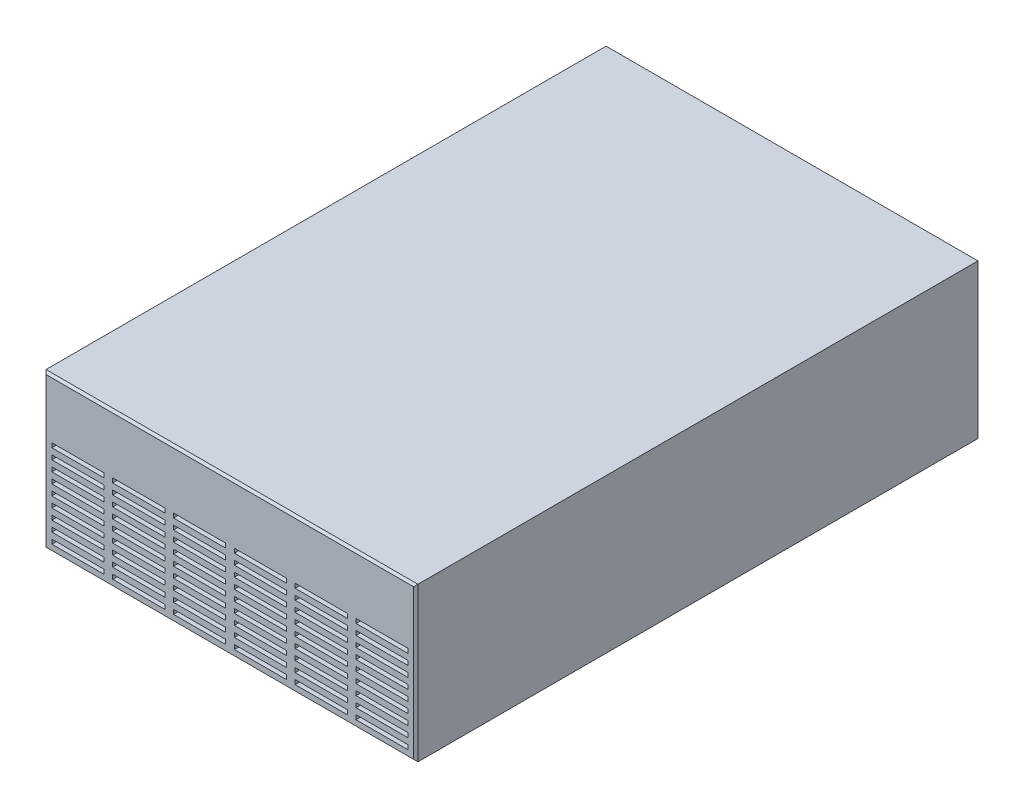
from build123d import *

# Parameters (mm, degrees)
SKETCH1_W           = 428
SKETCH1_H           = 177
BOSS_EXTRUDE1_DEPTH = 647
SKETCH2_W           = 60
SKETCH2_H           = 5
CUT_EXTRUDE1_DEPTH  = 5
CHAMFER1_SIZE       = 2.5


with BuildPart() as part:
    # Sketch1 → Boss-Extrude1 (new body)
    with BuildSketch(Plane.XY):
        with Locations((214, 88.5)):
            Rectangle(SKETCH1_W, SKETCH1_H)
    extrude(amount=-BOSS_EXTRUDE1_DEPTH)

    # Sketch2 → Cut-Extrude1 (cut)
    with BuildSketch(Plane.XY):
        with Locations((109.265806659, 11.356001872)):
            Rectangle(SKETCH2_W, SKETCH2_H)
        with Locations((39.265806659, 11.356001872)):
            Rectangle(SKETCH2_W, SKETCH2_H)
        with Locations((179.265806659, 11.356001872)):
            Rectangle(SKETCH2_W, SKETCH2_H)
        with Locations((249.265806659, 11.356001872)):
            Rectangle(SKETCH2_W, SKETCH2_H)
        with Locations((319.265806659, 11.356001872)):
            Rectangle(SKETCH2_W, SKETCH2_H)
        with Locations((389.265806659, 11.356001872)):
            Rectangle(SKETCH2_W, SKETCH2_H)
        with Locations((109.265806659, 23.356001872)):
            Rectangle(SKETCH2_W, SKETCH2_H)
        with Locations((179.265806659, 23.356001872)):
            Rectangle(SKETCH2_W, SKETCH2_H)
        with Locations((249.265806659, 23.356001872)):
            Rectangle(SKETCH2_W, SKETCH2_H)
        with Locations((319.265806659, 23.356001872)):
            Rectangle(SKETCH2_W, SKETCH2_H)
        with Locations((389.265806659, 23.356001872)):
            Rectangle(SKETCH2_W, SKETCH2_H)
        with Locations((109.265806659, 35.356001872)):
            Rectangle(SKETCH2_W, SKETCH2_H)
        with Locations((179.265806659, 35.356001872)):
            Rectangle(SKETCH2_W, SKETCH2_H)
        with Locations((249.265806659, 35.356001872)):
            Rectangle(SKETCH2_W, SKETCH2_H)
        with Locations((319.265806659, 35.356001872)):
            Rectangle(SKETCH2_W, SKETCH2_H)
        with Locations((389.265806659, 35.356001872)):
            Rectangle(SKETCH2_W, SKETCH2_H)
        with Locations((109.265806659, 47.356001872)):
            Rectangle(SKETCH2_W, SKETCH2_H)
        with Locations((179.265806659, 47.356001872)):
            Rectangle(SKETCH2_W, SKETCH2_H)
        with Locations((249.265806659, 47.356001872)):
            Rectangle(SKETCH2_W, SKETCH2_H)
        with Locations((319.265806659, 47.356001872)):
            Rectangle(SKETCH2_W, SKETCH2_H)
        with Locations((389.265806659, 47.356001872)):
            Rectangle(SKETCH2_W, SKETCH2_H)
        with Locations((109.265806659, 59.356001872)):
            Rectangle(SKETCH2_W, SKETCH2_H)
        with Locations((179.265806659, 59.356001872)):
            Rectangle(SKETCH2_W, SKETCH2_H)
        with Locations((249.265806659, 59.356001872)):
            Rectangle(SKETCH2_W, SKETCH2_H)
        with Locations((319.265806659, 59.356001872)):
            Rectangle(SKETCH2_W, SKETCH2_H)
        with Locations((389.265806659, 59.356001872)):
            Rectangle(SKETCH2_W, SKETCH2_H)
        with Locations((109.265806659, 71.356001872)):
            Rectangle(SKETCH2_W, SKETCH2_H)
        with Locations((179.265806659, 71.356001872)):
            Rectangle(SKETCH2_W, SKETCH2_H)
        with Locations((249.265806659, 71.356001872)):
            Rectangle(SKETCH2_W, SKETCH2_H)
        with Locations((319.265806659, 71.356001872)):
            Rectangle(SKETCH2_W, SKETCH2_H)
        with Locations((389.265806659, 71.356001872)):
            Rectangle(SKETCH2_W, SKETCH2_H)
        with Locations((109.265806659, 83.356001872)):
            Rectangle(SKETCH2_W, SKETCH2_H)
        with Locations((179.265806659, 83.356001872)):
            Rectangle(SKETCH2_W, SKETCH2_H)
        with Locations((249.265806659, 83.356001872)):
            Rectangle(SKETCH2_W, SKETCH2_H)
        with Locations((319.265806659, 83.356001872)):
            Rectangle(SKETCH2_W, SKETCH2_H)
        with Locations((389.265806659, 83.356001872)):
            Rectangle(SKETCH2_W, SKETCH2_H)
        with Locations((109.265806659, 95.356001872)):
            Rectangle(SKETCH2_W, SKETCH2_H)
        with Locations((179.265806659, 95.356001872)):
            Rectangle(SKETCH2_W, SKETCH2_H)
        with Locations((249.265806659, 95.356001872)):
            Rectangle(SKETCH2_W, SKETCH2_H)
        with Locations((319.265806659, 95.356001872)):
            Rectangle(SKETCH2_W, SKETCH2_H)
        with Locations((389.265806659, 95.356001872)):
            Rectangle(SKETCH2_W, SKETCH2_H)
        with Locations((109.265806659, 107.356001872)):
            Rectangle(SKETCH2_W, SKETCH2_H)
        with Locations((179.265806659, 107.356001872)):
            Rectangle(SKETCH2_W, SKETCH2_H)
        with Locations((249.265806659, 107.356001872)):
            Rectangle(SKETCH2_W, SKETCH2_H)
        with Locations((319.265806659, 107.356001872)):
            Rectangle(SKETCH2_W, SKETCH2_H)
        with Locations((389.265806659, 107.356001872)):
            Rectangle(SKETCH2_W, SKETCH2_H)
        with Locations((39.265806659, 23.356001872)):
            Rectangle(SKETCH2_W, SKETCH2_H)
        with Locations((39.265806659, 35.356001872)):
            Rectangle(SKETCH2_W, SKETCH2_H)
        with Locations((39.265806659, 47.356001872)):
            Rectangle(SKETCH2_W, SKETCH2_H)
        with Locations((39.265806659, 59.356001872)):
            Rectangle(SKETCH2_W, SKETCH2_H)
        with Locations((39.265806659, 71.356001872)):
            Rectangle(SKETCH2_W, SKETCH2_H)
        with Locations((39.265806659, 83.356001872)):
            Rectangle(SKETCH2_W, SKETCH2_H)
        with Locations((39.265806659, 95.356001872)):
            Rectangle(SKETCH2_W, SKETCH2_H)
        with Locations((39.265806659, 107.356001872)):
            Rectangle(SKETCH2_W, SKETCH2_H)
    extrude(amount=-CUT_EXTRUDE1_DEPTH, mode=Mode.SUBTRACT)

    # Chamfer1
    chamfer1_edges = [part.edges().sort_by_distance(p)[0] for p in [
        (214, 177, 0),
        (428, 88.5, 0),
        (214, 0, 0),
        (0, 88.5, 0),
    ]]
    chamfer(chamfer1_edges, length=CHAMFER1_SIZE)


solid = part.part
